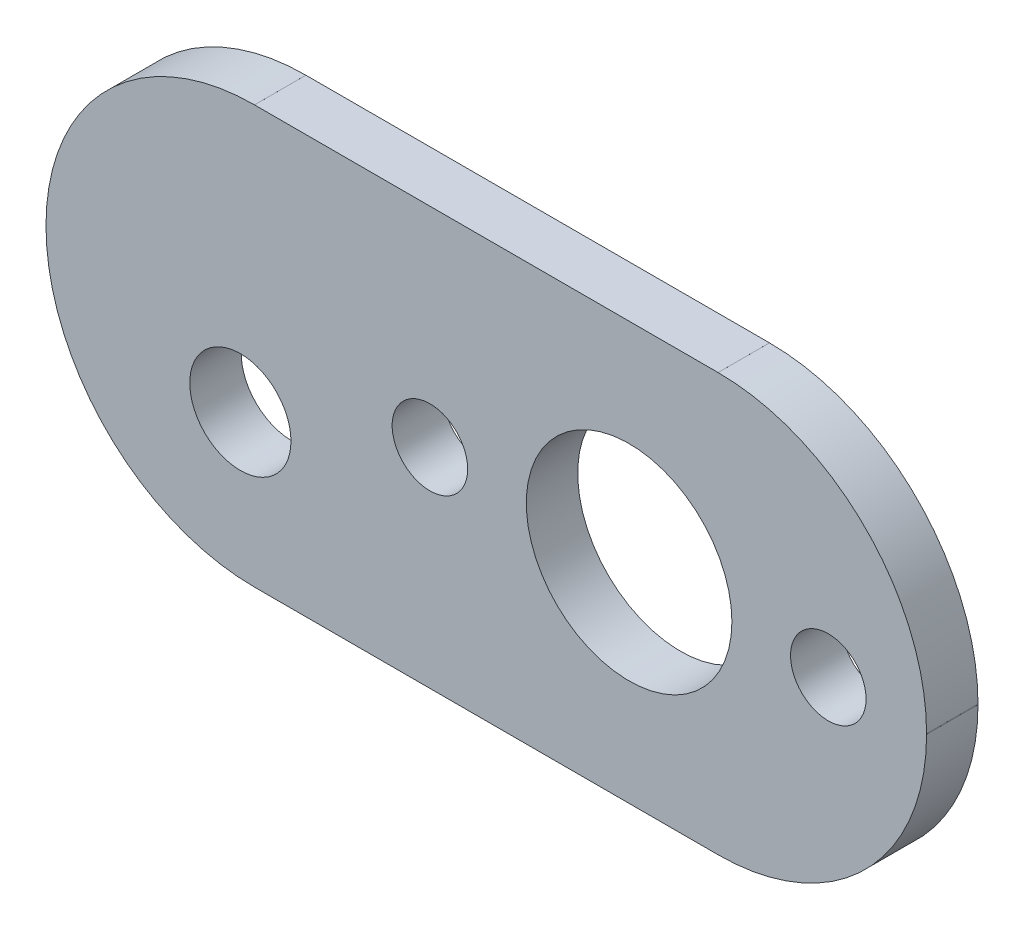
from build123d import *

# Parameters (mm, degrees)
MODEL_R                 = 0.0003
MODEL_R_2               = 0.0002
MODEL_R_3               = 0.00025
MODEL_R_4               = 1.175
MODEL_R_5               = 3.2
MODEL_R_6               = 1.575
SALIENTE_EXTRUIR1_DEPTH = 1.6


with BuildPart() as part:
    # Model → Saliente-Extruir1 (new body)
    # profile 1 of 9: a face of its own
    with BuildSketch(Plane.XY):
        with Locations((-11.66, -6.5)):
            Circle(MODEL_R)
    # profile 2 of 9: a face of its own
    with BuildSketch(Plane.XY):
        with Locations((2.77, -6.5)):
            Circle(MODEL_R)
    # profile 3 of 9: a face of its own
    with BuildSketch(Plane.XY):
        with Locations((9.26, -0.01)):
            Circle(MODEL_R_2)
    # profile 4 of 9: a face of its own
    with BuildSketch(Plane.XY):
        with Locations((9.26, 0.01)):
            Circle(MODEL_R_2)
    # profile 5 of 9: a face of its own
    with BuildSketch(Plane.XY):
        with Locations((2.77, 6.5)):
            Circle(MODEL_R)
    # profile 6 of 9: a face of its own
    with BuildSketch(Plane.XY):
        with Locations((-11.66, 6.5)):
            Circle(MODEL_R)
    # profile 7 of 9: a face of its own
    with BuildSketch(Plane.XY):
        with Locations((-18.15005, 0.01)):
            Circle(MODEL_R_3)
    # profile 8 of 9: a face of its own
    with BuildSketch(Plane.XY):
        with Locations((-18.15005, -0.01)):
            Circle(MODEL_R_3)
    # profile 9 of 9: a face of its own
    with BuildSketch(Plane.XY):
        with BuildLine():
            Line((-11.66, -6.5), (2.77, -6.5))
            ThreePointArc((2.77, -6.5), (7.359079, -4.599079), (9.26, -0.01))
            Line((9.26, -0.01), (9.26, 0.01))
            ThreePointArc((9.26, 0.01), (7.359079, 4.599079), (2.77, 6.5))
            Line((2.77, 6.5), (-11.66, 6.5))
            ThreePointArc((-11.66, 6.5), (-16.249079, 4.599079), (-18.15, 0.01))
            Line((-18.15, 0.01), (-18.15, -0.01))
            ThreePointArc((-18.15, -0.01), (-16.249079, -4.599079), (-11.66, -6.5))
        make_face()
        with Locations((6.2, 0)):
            Circle(MODEL_R_4, mode=Mode.SUBTRACT)
        with Locations((-6.2, 0)):
            Circle(MODEL_R_4, mode=Mode.SUBTRACT)
        Circle(MODEL_R_5, mode=Mode.SUBTRACT)
        with Locations((-12.1, -2)):
            Circle(MODEL_R_6, mode=Mode.SUBTRACT)
    extrude(amount=SALIENTE_EXTRUIR1_DEPTH)


solid = part.part
